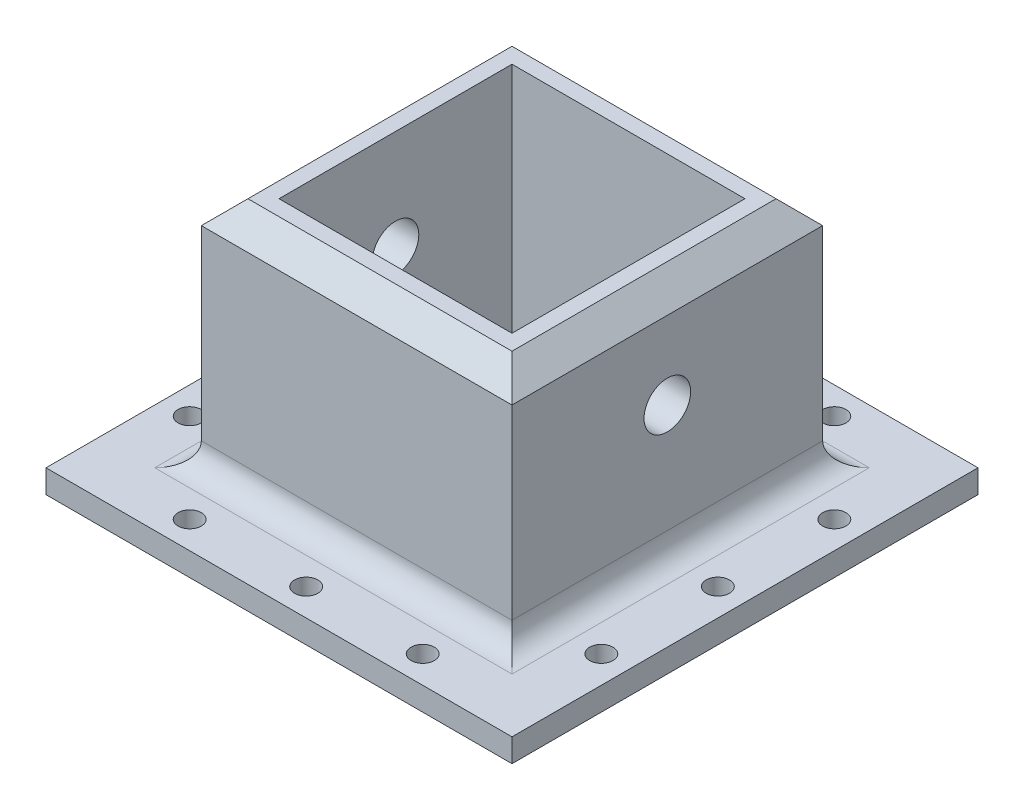
from build123d import *

# Parameters (mm, degrees)
CROQUIS1_W                 = 60
CROQUIS1_H                 = 60
SALIENTE_EXTRUIR1_DEPTH    = 3
CROQUIS2_W                 = 40
CROQUIS2_H                 = 40
CROQUIS2_W_2               = 30
CROQUIS2_H_2               = 30
SALIENTE_EXTRUIR2_DEPTH    = 30
CHAFL_N1_SIZE              = 3
REDONDEO1_R                = 3
CROQUIS3_R                 = 1.5
CORTAR_EXTRUIR1_DEPTH      = 30
CORTAR_EXTRUIR2_DEPTH      = 54.749418602
CORTAR_EXTRUIR2_DEPTH_BACK = 54.749418602
CROQUIS4_R                 = 3


with BuildPart() as part:
    # Croquis1 → Saliente-Extruir1 (new body)
    with BuildSketch(Plane(origin=(0, 0, 0), x_dir=(1, 0, 0), z_dir=(0, 1, 0))):
        Rectangle(CROQUIS1_W, CROQUIS1_H)
    extrude(amount=SALIENTE_EXTRUIR1_DEPTH)

    # Croquis2 → Saliente-Extruir2 (add)
    with BuildSketch(Plane(origin=(0, 3, 0), x_dir=(1, 0, 0), z_dir=(0, 1, 0))):
        Rectangle(CROQUIS2_W, CROQUIS2_H)
        Rectangle(CROQUIS2_W_2, CROQUIS2_H_2, mode=Mode.SUBTRACT)
    extrude(amount=SALIENTE_EXTRUIR2_DEPTH)

    # Chaflán1
    chafl_n1_edges = [part.edges().sort_by_distance(p)[0] for p in [
        (0, 33, 20),
        (20, 33, 0),
        (0, 33, -20),
        (-20, 33, 0),
    ]]
    chamfer(chafl_n1_edges, length=CHAFL_N1_SIZE)

    # Redondeo1
    redondeo1_edges = [part.edges().sort_by_distance(p)[0] for p in [
        (0, 3, 20),
        (20, 3, 0),
        (0, 3, -20),
        (-20, 3, 0),
    ]]
    fillet(redondeo1_edges, radius=REDONDEO1_R)

    # Croquis3 → Cortar-Extruir1 (cut)
    with BuildSketch(Plane(origin=(0, 3, 0), x_dir=(1, 0, 0), z_dir=(0, 1, 0))):
        with Locations(Location((0, 26.5, 0), (0, 0, 270))):
            Circle(CROQUIS3_R)
        with Locations(Location((15, 26.5, 0), (0, 0, 270))):
            Circle(CROQUIS3_R)
        with Locations(Location((-15, 26.5, 0), (0, 0, 90))):
            Circle(CROQUIS3_R)
        with Locations(Location((26.5, 15, 0), (0, 0, 90))):
            Circle(CROQUIS3_R)
        with Locations(Location((26.5, 0, 0), (0, 0, 270))):
            Circle(CROQUIS3_R)
        with Locations(Location((26.5, -15, 0), (0, 0, 270))):
            Circle(CROQUIS3_R)
        with Locations(Location((15, -26.5, 0), (0, 0, 90))):
            Circle(CROQUIS3_R)
        with Locations(Location((0, -26.5, 0), (0, 0, 270))):
            Circle(CROQUIS3_R)
        with Locations(Location((-15, -26.5, 0), (0, 0, 270))):
            Circle(CROQUIS3_R)
        with Locations(Location((-26.5, -15, 0), (0, 0, 90))):
            Circle(CROQUIS3_R)
        with Locations(Location((-26.5, 0, 0), (0, 0, 270))):
            Circle(CROQUIS3_R)
        with Locations(Location((-26.5, 15, 0), (0, 0, 270))):
            Circle(CROQUIS3_R)
    extrude(amount=-CORTAR_EXTRUIR1_DEPTH, mode=Mode.SUBTRACT)

    # Croquis4 → Cortar-Extruir2 (cut, two sides: drawn at the far end of the back side and taken through both)
    with BuildSketch(Plane(origin=(0, 0, 0), x_dir=(0, 0, -1), z_dir=(1, 0, 0)).offset(-CORTAR_EXTRUIR2_DEPTH_BACK)):
        with Locations((0, 20)):
            Circle(CROQUIS4_R)
    extrude(amount=CORTAR_EXTRUIR2_DEPTH + CORTAR_EXTRUIR2_DEPTH_BACK, mode=Mode.SUBTRACT)


solid = part.part
